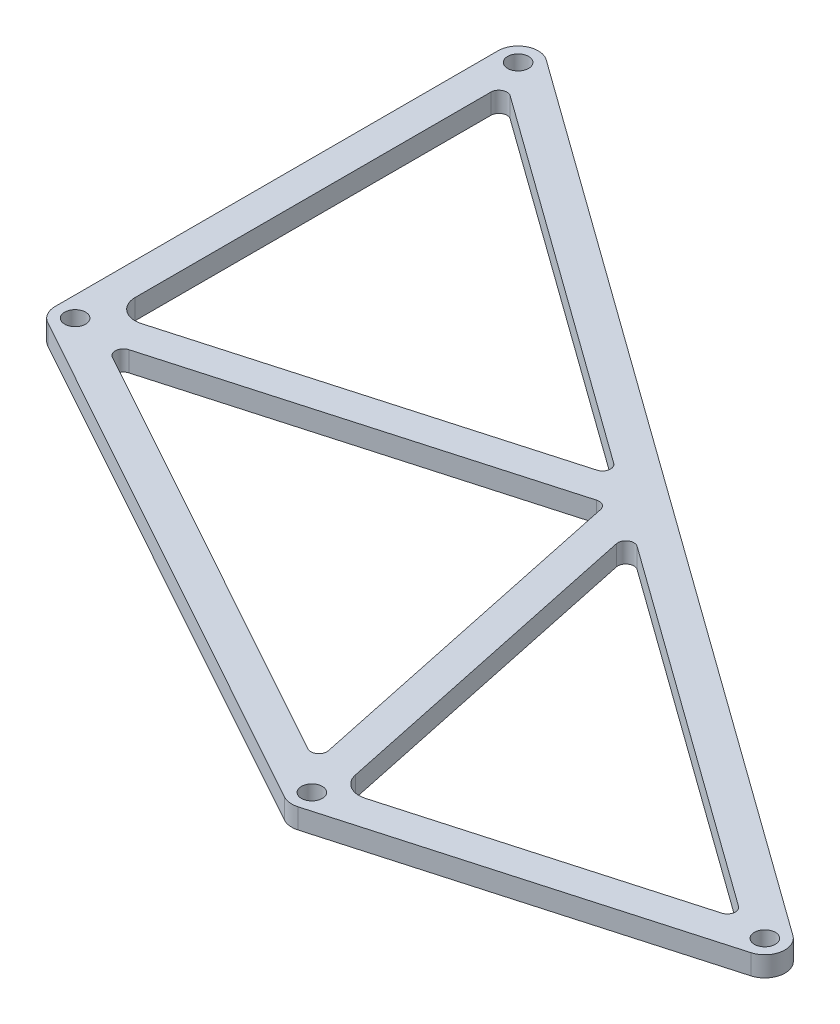
from build123d import *

# Parameters (mm, degrees)
SKETCH3_R           = 3.302
BOSS_EXTRUDE2_DEPTH = 6.35
CUT_EXTRUDE3_DEPTH  = 450.865121453
FILLET2_R           = 6.35
FILLET3_R           = 2.54
FILLET4_R           = 2.54
FILLET5_R           = 6.35
FILLET6_R           = 2.54
FILLET7_R           = 2.54


with BuildPart() as part:
    # Sketch3 → Boss-Extrude2 (new body)
    with BuildSketch(Plane(origin=(0, 0, 0), x_dir=(-1, 0, 0), z_dir=(0, 1, 0))):
        with BuildLine():
            Line((48.352684633, -96.934831966), (326.488935594, -297.252717824))
            ThreePointArc((326.488935594, -297.252717824), (333.094584687, -297.751891673), (336.55, -292.1))
            Line((336.55, -292.1), (336.55, -152.4))
            ThreePointArc((336.55, -152.4), (335.66916846, -149.173438927), (333.271040518, -146.842013841))
            Line((333.271040518, -146.842013841), (166.415977763, -54.646991456))
            ThreePointArc((166.415977763, -54.646991456), (164.068228098, -53.896304985), (161.611498988, -54.096156795))
            Line((161.611498988, -54.096156795), (50.330310781, -85.673293323))
            ThreePointArc((50.330310781, -85.673293323), (45.809453277, -90.683804291), (48.352684633, -96.934831966))
        make_face()
        with Locations(Location((52.063749039, -91.782114142, 0), (0, 0, 90))):
            Circle(SKETCH3_R, mode=Mode.SUBTRACT)
        with Locations(Location((163.344937246, -60.204977615, 0), (0, 0, 90))):
            Circle(SKETCH3_R, mode=Mode.SUBTRACT)
        with Locations(Location((330.2, -152.4, 0), (0, 0, 90))):
            Circle(SKETCH3_R, mode=Mode.SUBTRACT)
        with Locations(Location((330.2, -292.1, 0), (0, 0, 90))):
            Circle(SKETCH3_R, mode=Mode.SUBTRACT)
    extrude(amount=BOSS_EXTRUDE2_DEPTH)

    # Sketch9 → Cut-Extrude3 (cut, through all)
    with BuildSketch(Plane(origin=(0, 6.35, 0), x_dir=(1, 0, 0), z_dir=(0, 1, 0))):
        Polygon((-326.39, 284.660691911), (-201.3623279, 194.613893401), (-326.39, 159.064940036), align=None)
        Polygon((-319.046617377, 150.590173625), (-195.643102449, 185.677332519), (-170.986081265, 68.779983296), align=None)
        Polygon((-184.597750493, 182.539794136), (-60.685190052, 93.296115712), (-159.839017865, 65.160237505), align=None)
    extrude(amount=-CUT_EXTRUDE3_DEPTH, mode=Mode.SUBTRACT)

    # Fillet2
    fillet2_edges = [part.edges().sort_by_distance(p)[0] for p in [
        (-159.839017865, 3.175, -65.160237505),
    ]]
    fillet(fillet2_edges, radius=FILLET2_R)

    # Fillet3
    fillet3_edges = [part.edges().sort_by_distance(p)[0] for p in [
        (-170.986081265, 3.175, -68.779983296),
    ]]
    fillet(fillet3_edges, radius=FILLET3_R)

    # Fillet4
    fillet4_edges = [part.edges().sort_by_distance(p)[0] for p in [
        (-319.046617377, 3.175, -150.590173625),
    ]]
    fillet(fillet4_edges, radius=FILLET4_R)

    # Fillet5
    fillet5_edges = [part.edges().sort_by_distance(p)[0] for p in [
        (-326.39, 3.175, -159.064940036),
    ]]
    fillet(fillet5_edges, radius=FILLET5_R)

    # Fillet6
    fillet6_edges = [part.edges().sort_by_distance(p)[0] for p in [
        (-60.685190052, 3.175, -93.296115712),
        (-326.39, 3.175, -284.660691911),
    ]]
    fillet(fillet6_edges, radius=FILLET6_R)

    # Fillet7
    fillet7_edges = [part.edges().sort_by_distance(p)[0] for p in [
        (-195.643102449, 3.175, -185.677332519),
        (-184.597750493, 3.175, -182.539794136),
        (-201.3623279, 3.175, -194.613893401),
    ]]
    fillet(fillet7_edges, radius=FILLET7_R)


solid = part.part
